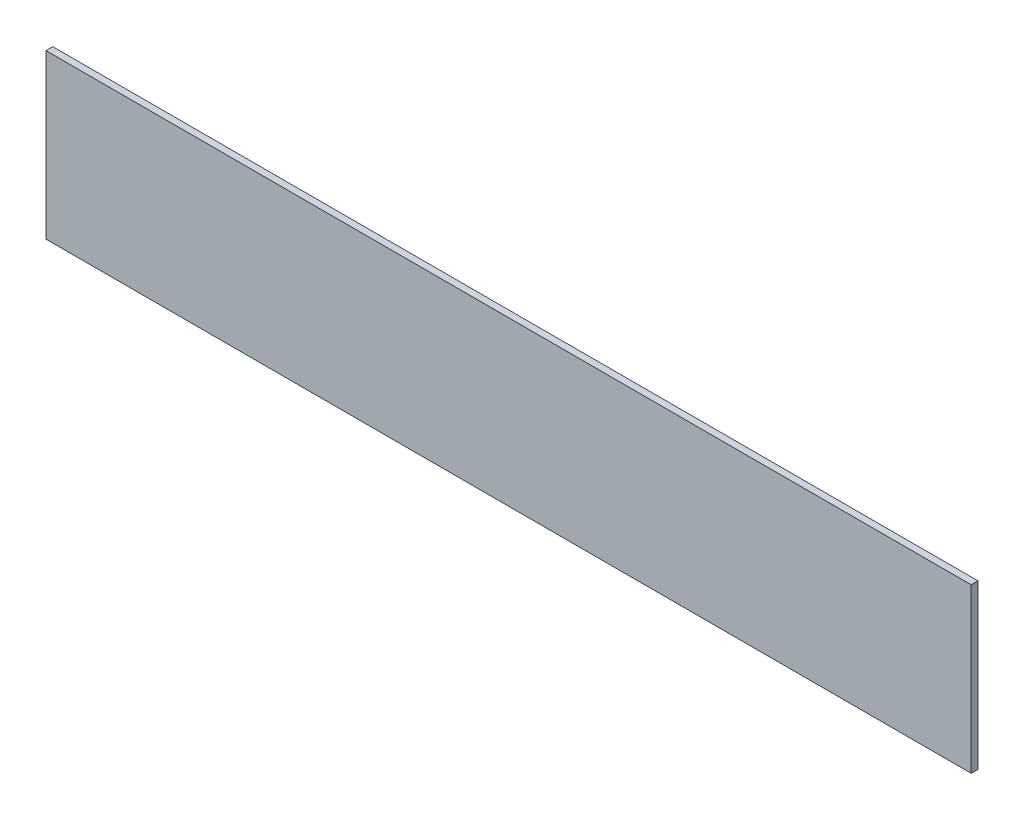
from build123d import *

# Parameters (mm, degrees)
SKETCH1_W           = 1727.2
SKETCH1_H           = 304.8
BOSS_EXTRUDE1_DEPTH = 6.35


with BuildPart() as part:
    # Sketch1 → Boss-Extrude1 (new, symmetric)
    with BuildSketch(Plane.XY):
        Rectangle(SKETCH1_W, SKETCH1_H)
    extrude(amount=BOSS_EXTRUDE1_DEPTH, both=True)


solid = part.part
